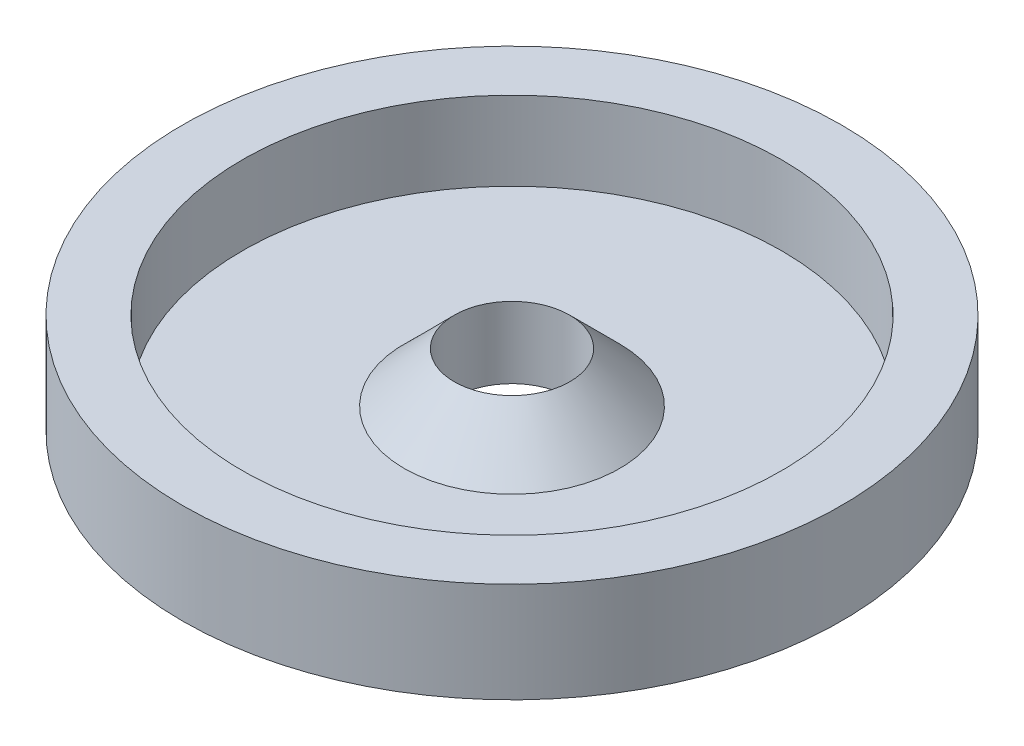
from build123d import *


with BuildPart() as part:
    # Sketch1 → Revolve1 (revolve)
    with BuildSketch(Plane.XY, mode=Mode.PRIVATE) as revolve1_sk:
        Polygon((3.75, 0), (21.4, 0), (21.4, 6.5), (17.5, 6.5), (17.5, 1.38), (7, 1.38), (3.75, 4.63), align=None)
    revolve(revolve1_sk.sketch.rotate(Axis((0, -10.862613982, 0), (0, 1, 0)), 90), axis=Axis((0, -10.862613982, 0), (0, 1, 0)))


solid = part.part
